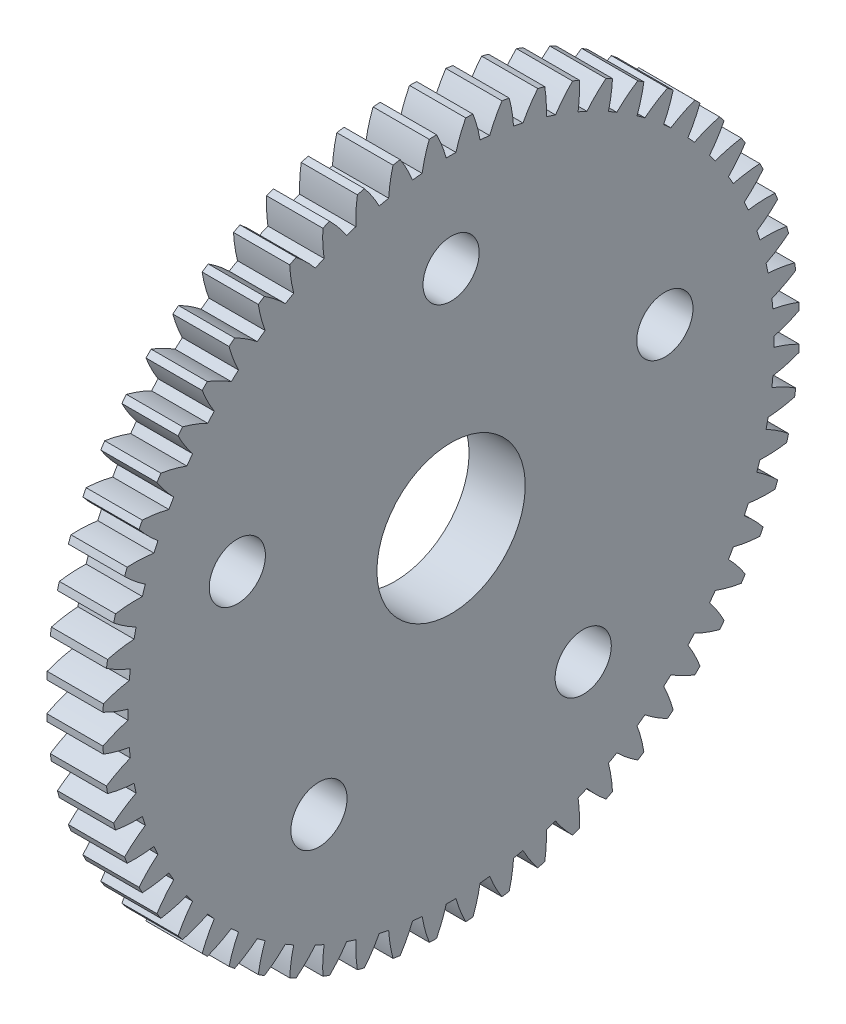
from build123d import *

# Parameters (mm, degrees)
BASPROSKE_W         = 5
BASPROSKE_H         = 31
TOOTHCUT_DEPTH      = 45.124822946
TEETHCUTS_COUNT     = 60
BORSKE_R            = 6.6
BORE_DEPTH          = 50.0000508
SKETCH_1_R          = 2.5
CUT_EXTRUDE_2_DEPTH = 5


with BuildPart() as part:
    # BasProSke → Base-Revolve (revolve)
    with BuildSketch(Plane(origin=(0, 0, 0), x_dir=(1, 0, 0), z_dir=(0, 1, 0)), mode=Mode.PRIVATE) as base_revolve_sk:
        with Locations((2.5, 15.5)):
            Rectangle(BASPROSKE_W, BASPROSKE_H)
    revolve(base_revolve_sk.sketch.rotate(Axis((-10, 0, 0), (1, 0, 0)), 180), axis=Axis((-10, 0, 0), (1, 0, 0)))

    # TooCutSke → ToothCut (cut, through all)
    with BuildSketch(Plane(origin=(0, 0, 0), x_dir=(0, 0, -1), z_dir=(1, 0, 0))):
        with BuildLine():
            ThreePointArc((0.430151971, 28.745781782), (0, 28.749), (-0.430151971, 28.745781782))
            ThreePointArc((-0.430151971, 28.745781782), (-0.81454129, 29.893990802), (-1.312684569, 30.997617721))
            ThreePointArc((-1.312684569, 30.997617721), (0, 31.0254), (1.312684569, 30.997617721))
            ThreePointArc((1.312684569, 30.997617721), (0.81454129, 29.893990802), (0.430151971, 28.745781782))
        make_face()
    toothcut = extrude(amount=TOOTHCUT_DEPTH, mode=Mode.SUBTRACT)

    # TeethCuts: ToothCut ×60 about axis
    teethcuts_axis = Axis((0, 0, 0), (1, 0, 0))
    for i in range(1, TEETHCUTS_COUNT):
        add(toothcut.rotate(teethcuts_axis, i * 360 / TEETHCUTS_COUNT), mode=Mode.SUBTRACT)

    # BorSke → Bore (cut, symmetric)
    with BuildSketch(Plane(origin=(0, 0, 0), x_dir=(0, 0, -1), z_dir=(1, 0, 0))):
        with Locations(Location((0, 0, 0), (0, 0, 180))):
            Circle(BORSKE_R)
    extrude(amount=BORE_DEPTH, both=True, mode=Mode.SUBTRACT)

    # 草图1 → 切除-拉伸2 (cut)
    with BuildSketch(Plane(origin=(5, 0, 0), x_dir=(0, 0, -1), z_dir=(1, 0, 0))):
        with Locations((0, 20)):
            Circle(SKETCH_1_R)
        with Locations((19.021130326, 6.180339887)):
            Circle(SKETCH_1_R)
        with Locations((11.755705046, -16.180339887)):
            Circle(SKETCH_1_R)
        with Locations((-11.755705046, -16.180339887)):
            Circle(SKETCH_1_R)
        with Locations((-19.021130326, 6.180339887)):
            Circle(SKETCH_1_R)
    extrude(amount=-CUT_EXTRUDE_2_DEPTH, mode=Mode.SUBTRACT)


solid = part.part
